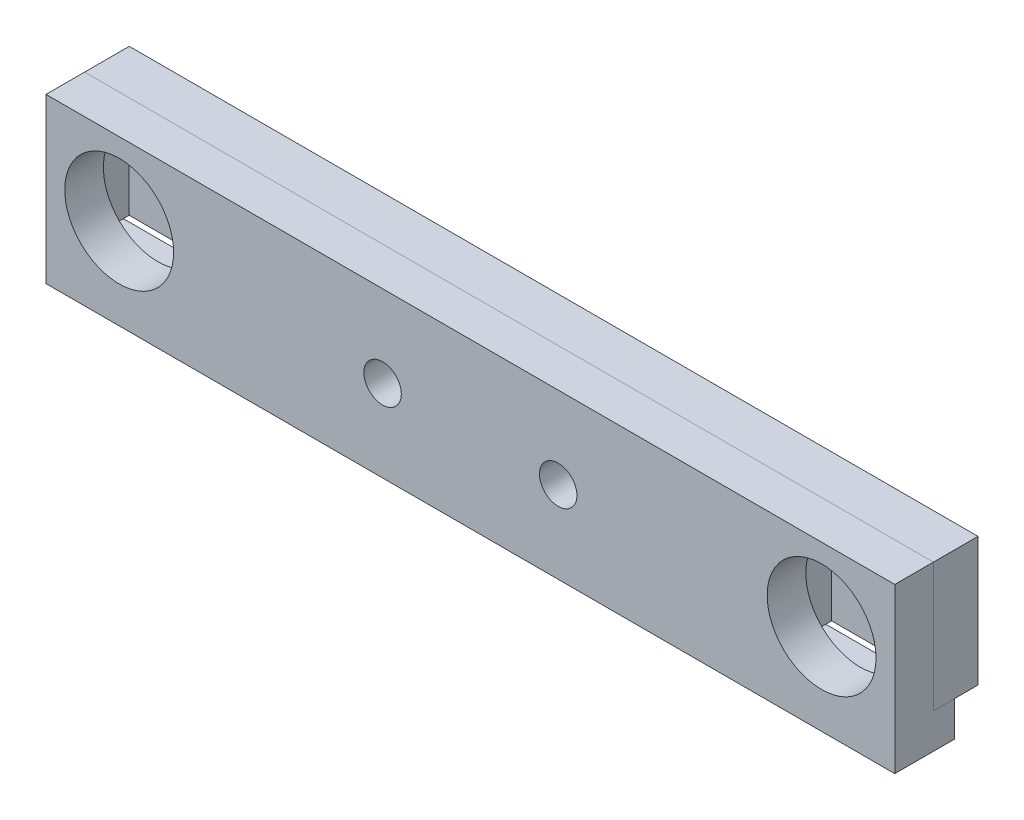
from build123d import *

# Parameters (mm, degrees)
SKETCH1_W           = 72.5
SKETCH1_H           = 11
BOSS_EXTRUDE1_DEPTH = 1.5
BOSS_EXTRUDE2_DEPTH = 2.31
SKETCH3_W           = 72.5
SKETCH3_H           = 14
SKETCH3_R           = 4.65
BOSS_EXTRUDE3_DEPTH = 3.3
SKETCH4_W           = 72.5
SKETCH4_H           = 3
BOSS_EXTRUDE4_DEPTH = 1.81
SKETCH5_R           = 1.6
CUT_EXTRUDE1_DEPTH  = 74.673618752


with BuildPart() as part:
    # Sketch1 → Boss-Extrude1 (new body)
    with BuildSketch(Plane.XY):
        with Locations((36.25, 5.5)):
            Rectangle(SKETCH1_W, SKETCH1_H)
    extrude(amount=BOSS_EXTRUDE1_DEPTH)

    # Sketch2 → Boss-Extrude2 (add)
    with BuildSketch(Plane.XY.offset(1.5)):
        Polygon((1.5, 9.5), (11, 9.5), (11, 0), (61.5, 0), (61.5, 9.5), (71, 9.5), (71, 0), (72.5, 0), (72.5, 11), (0, 11), (0, 0), (1.5, 0), align=None)
    extrude(amount=BOSS_EXTRUDE2_DEPTH)


with BuildPart() as body_2:
    # Sketch3 → Boss-Extrude3 (new body)
    with BuildSketch(Plane.XY.offset(3.81)):
        with Locations((36.25, 4)):
            Rectangle(SKETCH3_W, SKETCH3_H)
        with Locations((6.25, 4.75)):
            Circle(SKETCH3_R, mode=Mode.SUBTRACT)
        with Locations((66.25, 4.75)):
            Circle(SKETCH3_R, mode=Mode.SUBTRACT)
    extrude(amount=BOSS_EXTRUDE3_DEPTH)

    # Sketch4 → Boss-Extrude4 (add)
    with BuildSketch(Plane(origin=(0, 0, 3.81), x_dir=(-1, 0, 0), z_dir=(0, 0, -1))):
        with Locations((-36.25, -1.5)):
            Rectangle(SKETCH4_W, SKETCH4_H)
    extrude(amount=BOSS_EXTRUDE4_DEPTH)


with BuildPart() as cut_extrude1_tool:
    # Sketch5 → Cut-Extrude1 (new, through all)
    with BuildSketch(Plane.XY.offset(7.11)):
        with Locations((28.75, 4)):
            Circle(SKETCH5_R)
        with Locations((43.75, 4)):
            Circle(SKETCH5_R)
    extrude(amount=-CUT_EXTRUDE1_DEPTH)


with BuildPart() as part_1:
    add(part.part)

    # Cut-Extrude1: cut by cut_extrude1_tool
    add(cut_extrude1_tool.part, mode=Mode.SUBTRACT)


with BuildPart() as body_2_1:
    add(body_2.part)

    # Cut-Extrude1: cut by cut_extrude1_tool
    add(cut_extrude1_tool.part, mode=Mode.SUBTRACT)


solid = Compound([part_1.part, body_2_1.part])
